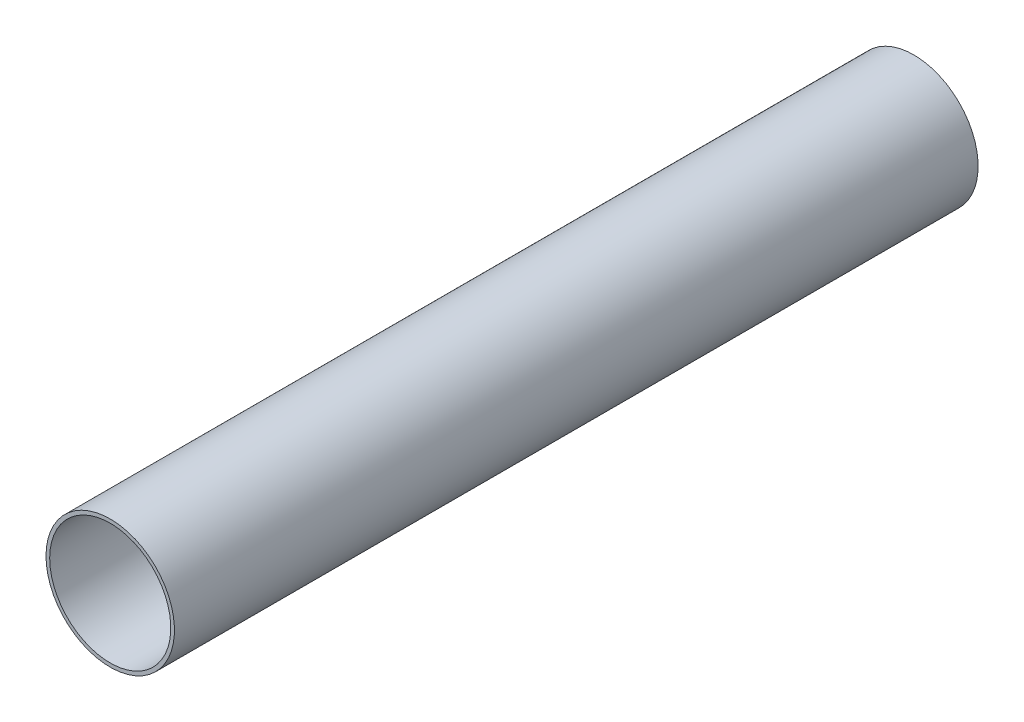
from build123d import *

# Parameters (mm, degrees)
SKETCH1_R           = 35
SKETCH1_R_2         = 33
BOSS_EXTRUDE1_DEPTH = 438


with BuildPart() as part:
    # Sketch1 → Boss-Extrude1 (new body)
    with BuildSketch(Plane.XY):
        with Locations(Location((0, 0, 0), (0, 0, 180))):
            Circle(SKETCH1_R)
        with Locations(Location((0, 0, 0), (0, 0, 180))):
            Circle(SKETCH1_R_2, mode=Mode.SUBTRACT)
    extrude(amount=BOSS_EXTRUDE1_DEPTH)


solid = part.part
